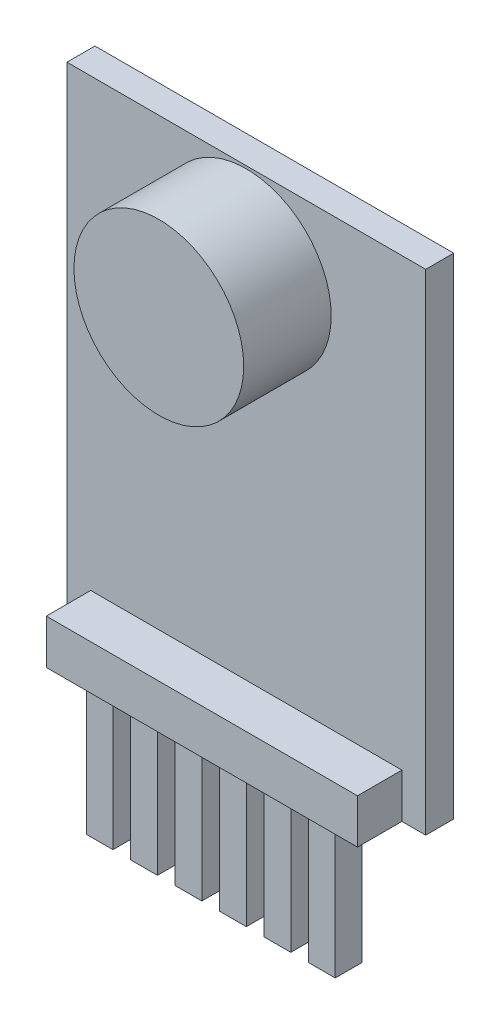
from build123d import *

# Parameters (mm, degrees)
SKETCH1_W             = 20.5
SKETCH1_H             = 28
BOSS_EXTRUDE1_DEPTH   = 1.6
SKETCH2_R             = 4.85
BOSS_EXTRUDE2_DEPTH   = 5
SKETCH3_W             = 17.78
SKETCH3_H             = 2.54
BOSS_EXTRUDE3_DEPTH   = 2.54
SKETCH4_W             = 1.524
SKETCH4_H             = 1.524
BOSS_EXTRUDE4_DEPTH   = 7.62
BOSS_EXTRUDE4_2_DEPTH = 7.62
BOSS_EXTRUDE4_3_DEPTH = 7.62
BOSS_EXTRUDE4_4_DEPTH = 7.62
BOSS_EXTRUDE4_5_DEPTH = 7.62
BOSS_EXTRUDE4_6_DEPTH = 7.62


with BuildPart() as part:
    # Sketch1 → Boss-Extrude1 (new body)
    with BuildSketch(Plane.XY):
        with Locations((10.25, 14)):
            Rectangle(SKETCH1_W, SKETCH1_H)
    extrude(amount=BOSS_EXTRUDE1_DEPTH)


with BuildPart() as body_2:
    # Sketch2 → Boss-Extrude2 (new body)
    with BuildSketch(Plane.XY.offset(1.6)):
        with Locations((10.25, 23)):
            Circle(SKETCH2_R)
    extrude(amount=BOSS_EXTRUDE2_DEPTH)


with BuildPart() as body_3:
    # Sketch3 → Boss-Extrude3 (new body)
    with BuildSketch(Plane.XY.offset(1.6)):
        with Locations((10.25, 1.27)):
            Rectangle(SKETCH3_W, SKETCH3_H)
    extrude(amount=BOSS_EXTRUDE3_DEPTH)


with BuildPart() as body_4:
    # Sketch4 → Boss-Extrude4 (new body)
    with BuildSketch(Plane.XZ):
        with Locations((3.9, 2.87)):
            Rectangle(SKETCH4_W, SKETCH4_H)
    extrude(amount=BOSS_EXTRUDE4_DEPTH)


with BuildPart() as body_5:
    # Sketch4 → Boss-Extrude4 2 (new body)
    with BuildSketch(Plane.XZ):
        with Locations((6.44, 2.87)):
            Rectangle(SKETCH4_W, SKETCH4_H)
    extrude(amount=BOSS_EXTRUDE4_2_DEPTH)


with BuildPart() as body_6:
    # Sketch4 → Boss-Extrude4 3 (new body)
    with BuildSketch(Plane.XZ):
        with Locations((8.98, 2.87)):
            Rectangle(SKETCH4_W, SKETCH4_H)
    extrude(amount=BOSS_EXTRUDE4_3_DEPTH)


with BuildPart() as body_7:
    # Sketch4 → Boss-Extrude4 4 (new body)
    with BuildSketch(Plane.XZ):
        with Locations((11.52, 2.87)):
            Rectangle(SKETCH4_W, SKETCH4_H)
    extrude(amount=BOSS_EXTRUDE4_4_DEPTH)


with BuildPart() as body_8:
    # Sketch4 → Boss-Extrude4 5 (new body)
    with BuildSketch(Plane.XZ):
        with Locations((14.06, 2.87)):
            Rectangle(SKETCH4_W, SKETCH4_H)
    extrude(amount=BOSS_EXTRUDE4_5_DEPTH)


with BuildPart() as body_9:
    # Sketch4 → Boss-Extrude4 6 (new body)
    with BuildSketch(Plane.XZ):
        with Locations((16.6, 2.87)):
            Rectangle(SKETCH4_W, SKETCH4_H)
    extrude(amount=BOSS_EXTRUDE4_6_DEPTH)


solid = Compound([part.part, body_2.part, body_3.part, body_4.part, body_5.part, body_6.part, body_7.part, body_8.part, body_9.part])
